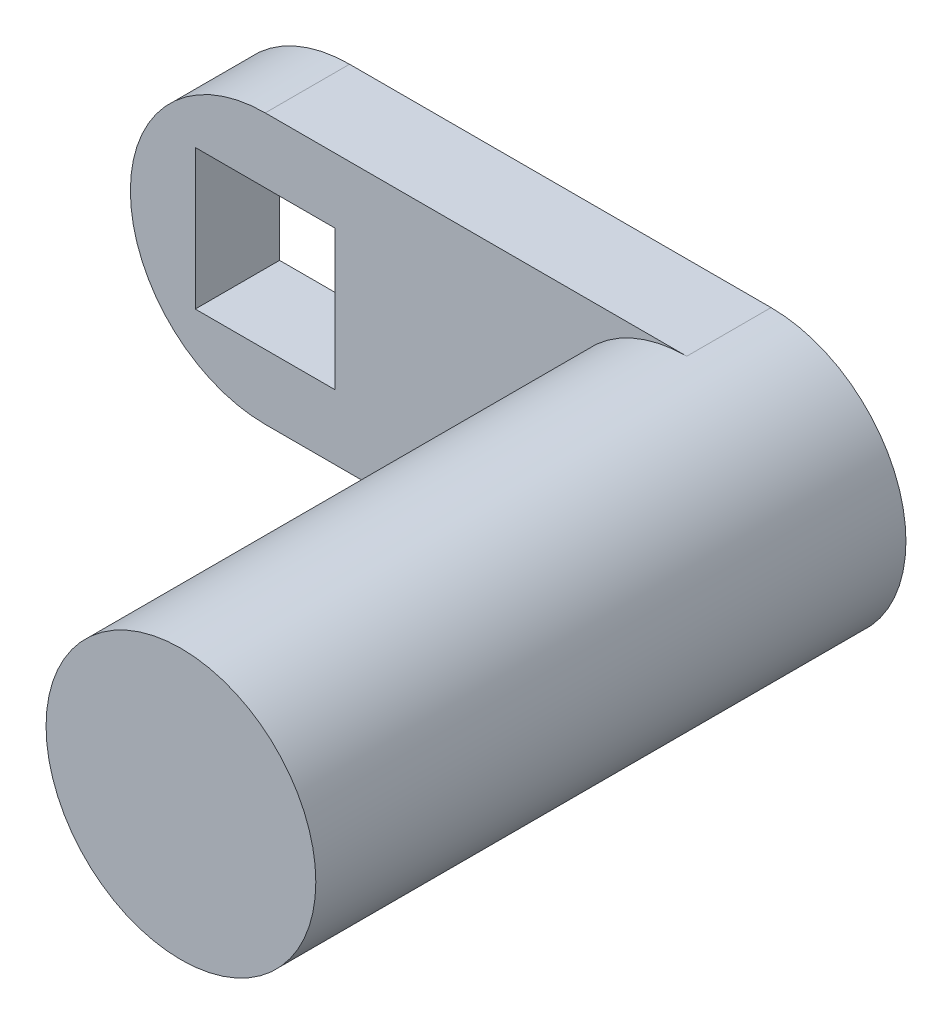
from build123d import *

# Parameters (mm, degrees)
SKETCH1_W           = 8.3
SKETCH1_H           = 8.3
BOSS_EXTRUDE1_DEPTH = 5
SKETCH2_R           = 8
BOSS_EXTRUDE2_DEPTH = 30


with BuildPart() as part:
    # Sketch1 → Boss-Extrude1 (new body)
    with BuildSketch(Plane.XY):
        with BuildLine():
            Line((0, 8), (25, 8))
            ThreePointArc((25, 8), (33, 0), (25, -8))
            Line((25, -8), (0, -8))
            ThreePointArc((0, -8), (-8, 0), (0, 8))
        make_face()
        Rectangle(SKETCH1_W, SKETCH1_H, mode=Mode.SUBTRACT)
    extrude(amount=BOSS_EXTRUDE1_DEPTH)

    # Sketch2 → Boss-Extrude2 (add)
    with BuildSketch(Plane.XY.offset(5)):
        with Locations(Location((25, 0, 0), (0, 0, 90))):
            Circle(SKETCH2_R)
    extrude(amount=BOSS_EXTRUDE2_DEPTH)


solid = part.part
